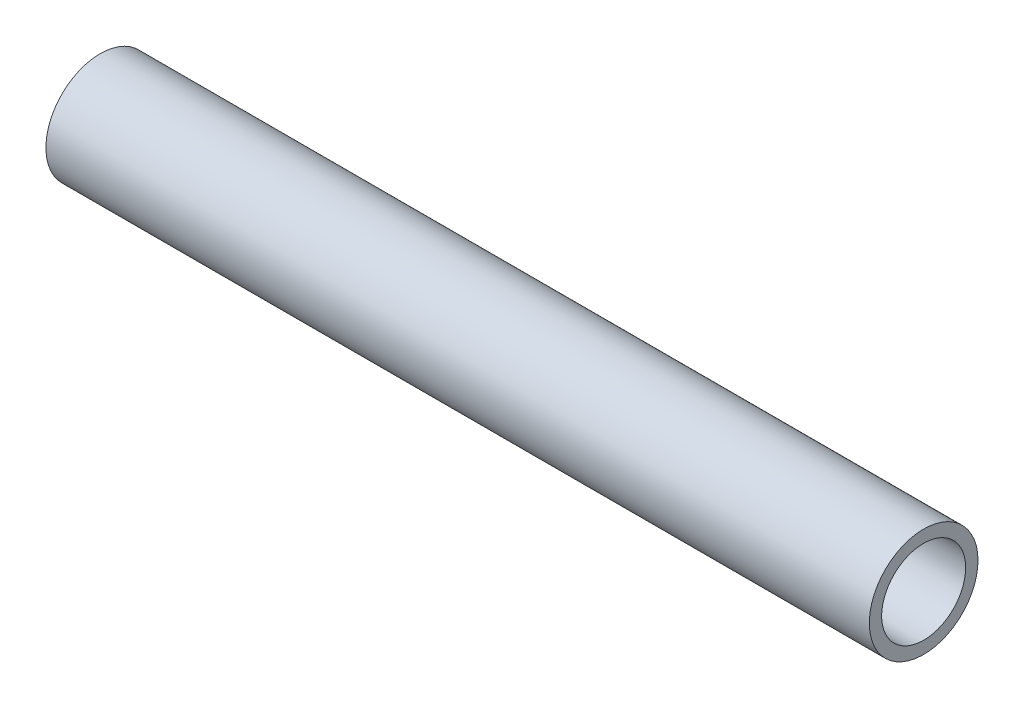
from build123d import *

# Parameters (mm, degrees)
SKETCH1_R           = 6.6
SKETCH1_R_2         = 5.1
BOSS_EXTRUDE1_DEPTH = 100


with BuildPart() as part:
    # Sketch1 → Boss-Extrude1 (new body)
    with BuildSketch(Plane(origin=(0, 0, 0), x_dir=(0, 0, -1), z_dir=(1, 0, 0))):
        Circle(SKETCH1_R)
        Circle(SKETCH1_R_2, mode=Mode.SUBTRACT)
    extrude(amount=BOSS_EXTRUDE1_DEPTH)


solid = part.part
